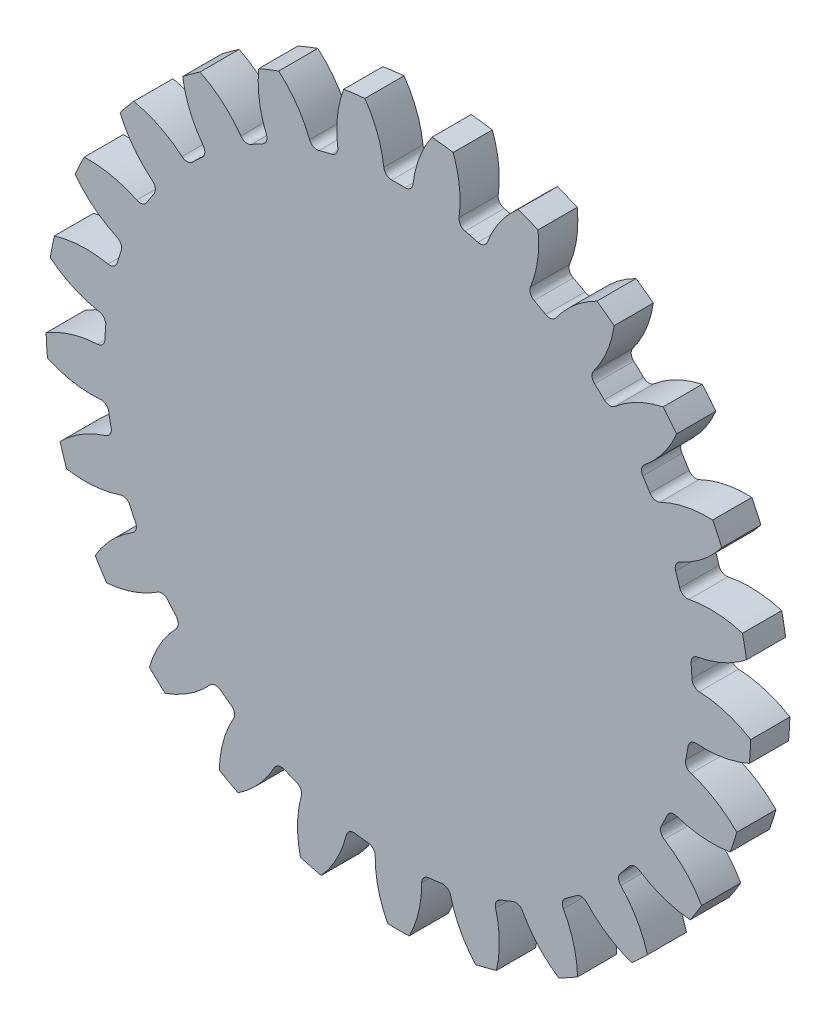
from build123d import *

# Parameters (mm, degrees)
SKETCH1_R                = 685.8
BOSS_EXTRUDE1_DEPTH      = 76.2
CUT_EXTRUDE1_DEPTH       = 76.2
FILLET1_R                = 15.24
CIRPATTERN1_COUNT        = 25
FILLET1_OF_CIRPATTERN1_R = 15.24


with BuildPart() as part:
    # Sketch1 → Boss-Extrude1 (new body)
    with BuildSketch(Plane.XY):
        with Locations(Location((0, 0, 0), (0, 0, 180))):
            Circle(SKETCH1_R)
    extrude(amount=BOSS_EXTRUDE1_DEPTH)

    # Sketch2 → Cut-Extrude1 (cut)
    with BuildSketch(Plane.XY.offset(76.2)):
        with BuildLine():
            ThreePointArc((-27.229372463, 570.850953643), (-38.545259271, 629.993391775), (-65.913422228, 683.629768786))
            ThreePointArc((-65.913422228, 683.629768786), (0, 686.8), (65.913422228, 683.629768786))
            ThreePointArc((65.913422228, 683.629768786), (38.545259271, 629.993391775), (27.229372463, 570.850953643))
            ThreePointArc((27.229372463, 570.850953643), (0, 571.5), (-27.229372463, 570.850953643))
        make_face()
    cut_extrude1 = extrude(amount=-CUT_EXTRUDE1_DEPTH, mode=Mode.SUBTRACT)

    # Fillet1
    fillet1_edges = [part.edges().sort_by_distance(p)[0] for p in [
        (-27.229372463, 570.850953643, 38.1),
        (27.229372463, 570.850953643, 38.1),
    ]]
    fillet(fillet1_edges, radius=FILLET1_R)

    # CirPattern1: Cut-Extrude1 ×25 about axis
    cirpattern1_axis = Axis((0, 0, 0), (0, 0, 1))
    for i in range(1, CIRPATTERN1_COUNT):
        add(cut_extrude1.rotate(cirpattern1_axis, i * 360 / CIRPATTERN1_COUNT), mode=Mode.SUBTRACT)

    # Fillet1 of CirPattern1
    fillet1_of_cirpattern1_edges = [part.edges().sort_by_distance(p)[0] for p in [
        (-168.338770905, 546.144951647, 38.1),
        (-115.590947593, 559.688290778, 38.1),
        (-298.870825265, 487.122653759, 38.1),
        (-251.148263299, 513.358354215, 38.1),
        (-410.623726503, 397.492648023, 38.1),
        (-370.925009963, 434.772224255, 38.1),
        (-496.575628837, 282.886717337, 38.1),
        (-467.395174084, 328.867756466, 38.1),
        (-551.325858133, 150.505973815, 38.1),
        (-534.497180458, 202.299318047, 38.1),
        (-571.434256128, 8.668386436, 38.1),
        (-568.014763241, 63.01966947, 38.1),
        (-555.637338222, -133.713867542, 38.1),
        (-565.841889437, -80.21973671, 38.1),
        (-504.927682865, -267.694387458, 38.1),
        (-528.115088699, -218.418641805, 38.1),
        (-422.491564199, -384.854684498, 38.1),
        (-457.204874667, -342.893500348, 38.1),
        (-313.50874674, -477.833146315, 38.1),
        (-357.566796877, -445.823099189, 38.1),
        (-184.827021718, -540.787594202, 38.1),
        (-235.461482201, -520.739993086, 38.1),
        (-44.531935175, -569.762368667, 38.1),
        (-98.561256632, -562.93687807, 38.1),
        (98.561256632, -562.93687807, 38.1),
        (44.531935175, -569.762368667, 38.1),
        (235.461482201, -520.739993086, 38.1),
        (184.827021718, -540.787594202, 38.1),
        (357.566796877, -445.823099189, 38.1),
        (313.50874674, -477.833146315, 38.1),
        (457.204874667, -342.893500348, 38.1),
        (422.491564199, -384.854684498, 38.1),
        (528.115088699, -218.418641805, 38.1),
        (504.927682865, -267.694387458, 38.1),
        (565.841889437, -80.21973671, 38.1),
        (555.637338222, -133.713867542, 38.1),
        (568.014763241, 63.01966947, 38.1),
        (571.434256128, 8.668386436, 38.1),
        (534.497180458, 202.299318047, 38.1),
        (551.325858133, 150.505973815, 38.1),
        (467.395174084, 328.867756466, 38.1),
        (496.575628837, 282.886717337, 38.1),
        (370.925009963, 434.772224255, 38.1),
        (410.623726503, 397.492648023, 38.1),
        (251.148263299, 513.358354215, 38.1),
        (298.870825265, 487.122653759, 38.1),
        (115.590947593, 559.688290778, 38.1),
        (168.338770905, 546.144951647, 38.1),
    ]]
    fillet(fillet1_of_cirpattern1_edges, radius=FILLET1_OF_CIRPATTERN1_R)


solid = part.part
